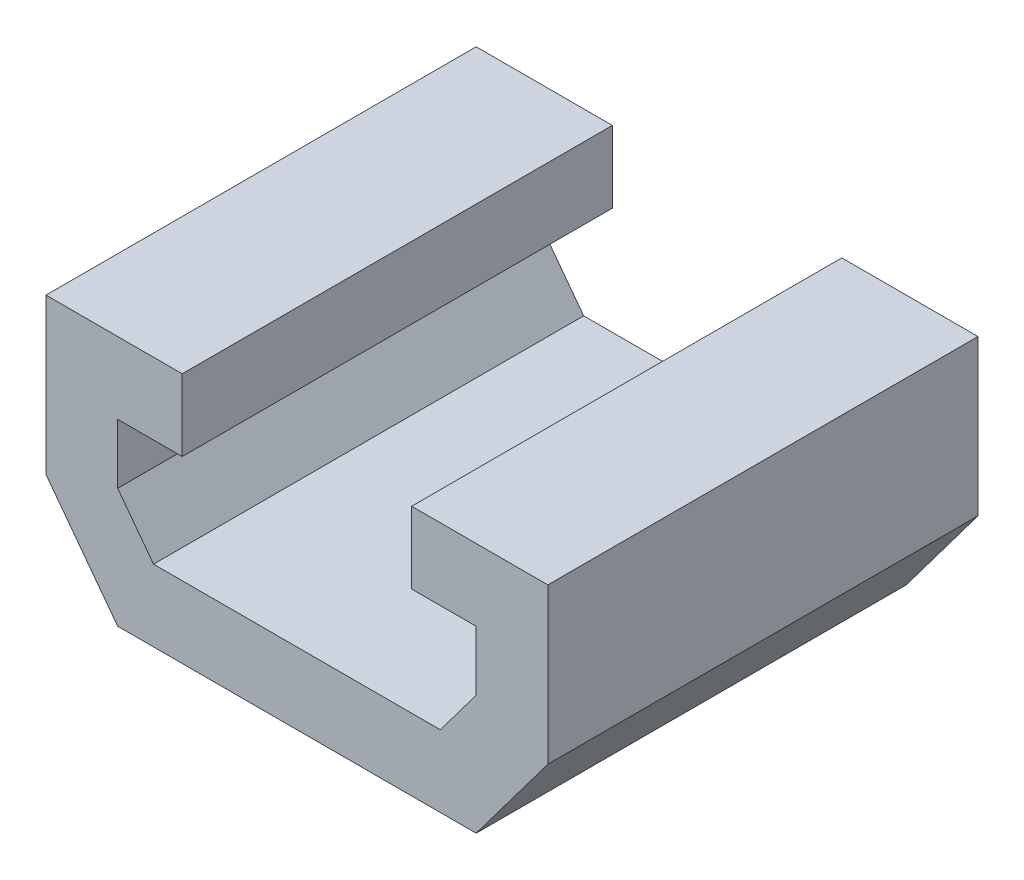
from build123d import *

# Parameters (mm, degrees)
EXTRUDE_THIN1_DEPTH = 7.62


with BuildPart() as part:
    # Sketch1 → Extrude-Thin1 (new body)
    with BuildSketch(Plane.XY):
        Polygon((0, 0), (-2.54, 0), (-3.175, 0.846666667), (-3.175, 1.905), (-2.032, 1.905), (-2.032, 3.175), (-4.445, 3.175), (-4.445, 0.423333333), (-3.175, -1.27), (0, -1.27), align=None)
    extrude(amount=EXTRUDE_THIN1_DEPTH)

    # Mirror1: part across plane


with BuildPart() as part_1:
    add(part.part)
    add(part.part.mirror(Plane(origin=(0, 0, 7.62), x_dir=(0, 0, 1), z_dir=(1, 0, 0))))


solid = part_1.part
